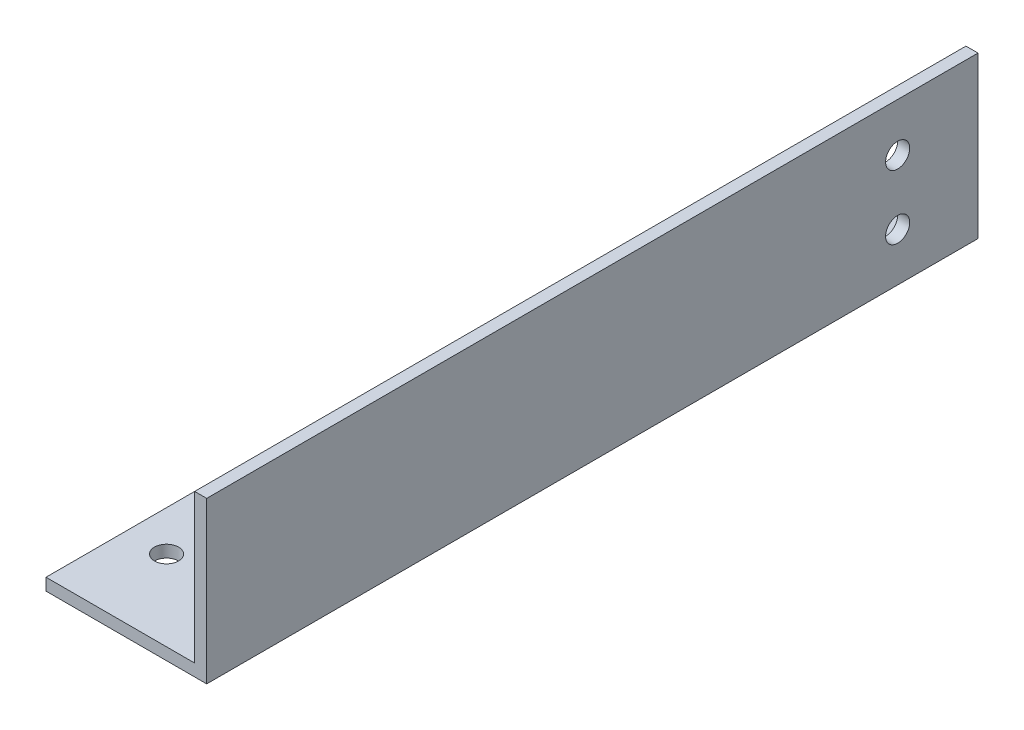
from build123d import *

# Parameters (mm, degrees)
EXTRUSION1_DEPTH = 96
ESQUISSE2_R      = 1.5
EXTRUSION2_DEPTH = 70
ESQUISSE3_R      = 1.5
EXTRUSION3_DEPTH = 10


with BuildPart() as part:
    # Esquisse1 → Extrusion1 (new body)
    with BuildSketch(Plane.XY):
        Polygon((-3.718958969, 18.5), (-3.718958969, -1.5), (-23.718958969, -1.5), (-23.718958969, 0), (-5.218958969, 0), (-5.218958969, 18.5), align=None)
    extrude(amount=EXTRUSION1_DEPTH)

    # Esquisse2 → Extrusion2 (cut)
    with BuildSketch(Plane.XZ.offset(1.5)):
        with Locations((-8.718958969, 86)):
            Circle(ESQUISSE2_R)
        with Locations((-18.718958969, 86)):
            Circle(ESQUISSE2_R)
    extrude(amount=-EXTRUSION2_DEPTH, mode=Mode.SUBTRACT)

    # Esquisse3 → Extrusion3 (cut)
    with BuildSketch(Plane(origin=(-3.718958969, 0, 0), x_dir=(0, 0, -1), z_dir=(1, 0, 0))):
        with Locations(Location((-10, 12.5, 0), (0, 0, 90))):
            Circle(ESQUISSE3_R)
        with Locations(Location((-10, 4.5, 0), (0, 0, 90))):
            Circle(ESQUISSE3_R)
    extrude(amount=-EXTRUSION3_DEPTH, mode=Mode.SUBTRACT)


solid = part.part
